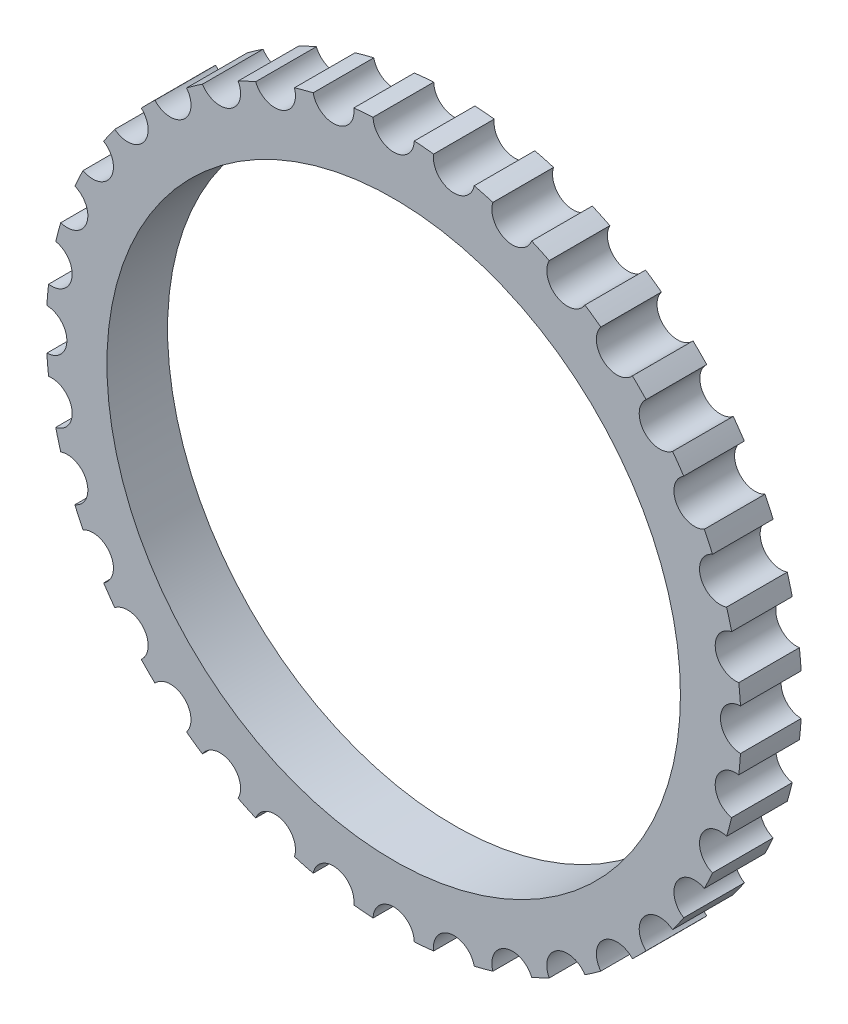
from build123d import *

# Parameters (mm, degrees)
SKETCH1_R           = 28.645714286
SKETCH1_R_2         = 23.645714286
BOSS_EXTRUDE1_DEPTH = 5
SKETCH3_R           = 1.7
CUT_EXTRUDE1_DEPTH  = 8


with BuildPart() as part:
    # Sketch1 → Boss-Extrude1 (new body)
    with BuildSketch(Plane.XY):
        Circle(SKETCH1_R)
        Circle(SKETCH1_R_2, mode=Mode.SUBTRACT)
    extrude(amount=BOSS_EXTRUDE1_DEPTH)

    # Sketch3 → Cut-Extrude1 (cut, symmetric)
    with BuildSketch(Plane.XY.offset(2.5)):
        with Locations((28.645714286, 0)):
            Circle(SKETCH3_R)
        with Locations((28.210521519, -4.974276084)):
            Circle(SKETCH3_R)
        with Locations((26.918166331, -9.797411306)):
            Circle(SKETCH3_R)
        with Locations((24.807916281, -14.322857143)):
            Circle(SKETCH3_R)
        with Locations((21.943890248, -18.413110214)):
            Circle(SKETCH3_R)
        with Locations((18.413110214, -21.943890248)):
            Circle(SKETCH3_R)
        with Locations((14.322857143, -24.807916281)):
            Circle(SKETCH3_R)
        with Locations((9.797411306, -26.918166331)):
            Circle(SKETCH3_R)
        with Locations((4.974276084, -28.210521519)):
            Circle(SKETCH3_R)
        with Locations((0, -28.645714286)):
            Circle(SKETCH3_R)
        with Locations((-4.974276084, -28.210521519)):
            Circle(SKETCH3_R)
        with Locations((-9.797411306, -26.918166331)):
            Circle(SKETCH3_R)
        with Locations((-14.322857143, -24.807916281)):
            Circle(SKETCH3_R)
        with Locations((-18.413110214, -21.943890248)):
            Circle(SKETCH3_R)
        with Locations((-21.943890248, -18.413110214)):
            Circle(SKETCH3_R)
        with Locations((-24.807916281, -14.322857143)):
            Circle(SKETCH3_R)
        with Locations((-26.918166331, -9.797411306)):
            Circle(SKETCH3_R)
        with Locations((-28.210521519, -4.974276084)):
            Circle(SKETCH3_R)
        with Locations((-28.645714286, 0)):
            Circle(SKETCH3_R)
        with Locations((-28.210521519, 4.974276084)):
            Circle(SKETCH3_R)
        with Locations((-26.918166331, 9.797411306)):
            Circle(SKETCH3_R)
        with Locations((-24.807916281, 14.322857143)):
            Circle(SKETCH3_R)
        with Locations((-21.943890248, 18.413110214)):
            Circle(SKETCH3_R)
        with Locations((-18.413110214, 21.943890248)):
            Circle(SKETCH3_R)
        with Locations((-14.322857143, 24.807916281)):
            Circle(SKETCH3_R)
        with Locations((-9.797411306, 26.918166331)):
            Circle(SKETCH3_R)
        with Locations((-4.974276084, 28.210521519)):
            Circle(SKETCH3_R)
        with Locations((0, 28.645714286)):
            Circle(SKETCH3_R)
        with Locations((4.974276084, 28.210521519)):
            Circle(SKETCH3_R)
        with Locations((9.797411306, 26.918166331)):
            Circle(SKETCH3_R)
        with Locations((14.322857143, 24.807916281)):
            Circle(SKETCH3_R)
        with Locations((18.413110214, 21.943890248)):
            Circle(SKETCH3_R)
        with Locations((21.943890248, 18.413110214)):
            Circle(SKETCH3_R)
        with Locations((24.807916281, 14.322857143)):
            Circle(SKETCH3_R)
        with Locations((26.918166331, 9.797411306)):
            Circle(SKETCH3_R)
        with Locations((28.210521519, 4.974276084)):
            Circle(SKETCH3_R)
    extrude(amount=CUT_EXTRUDE1_DEPTH, both=True, mode=Mode.SUBTRACT)


solid = part.part
